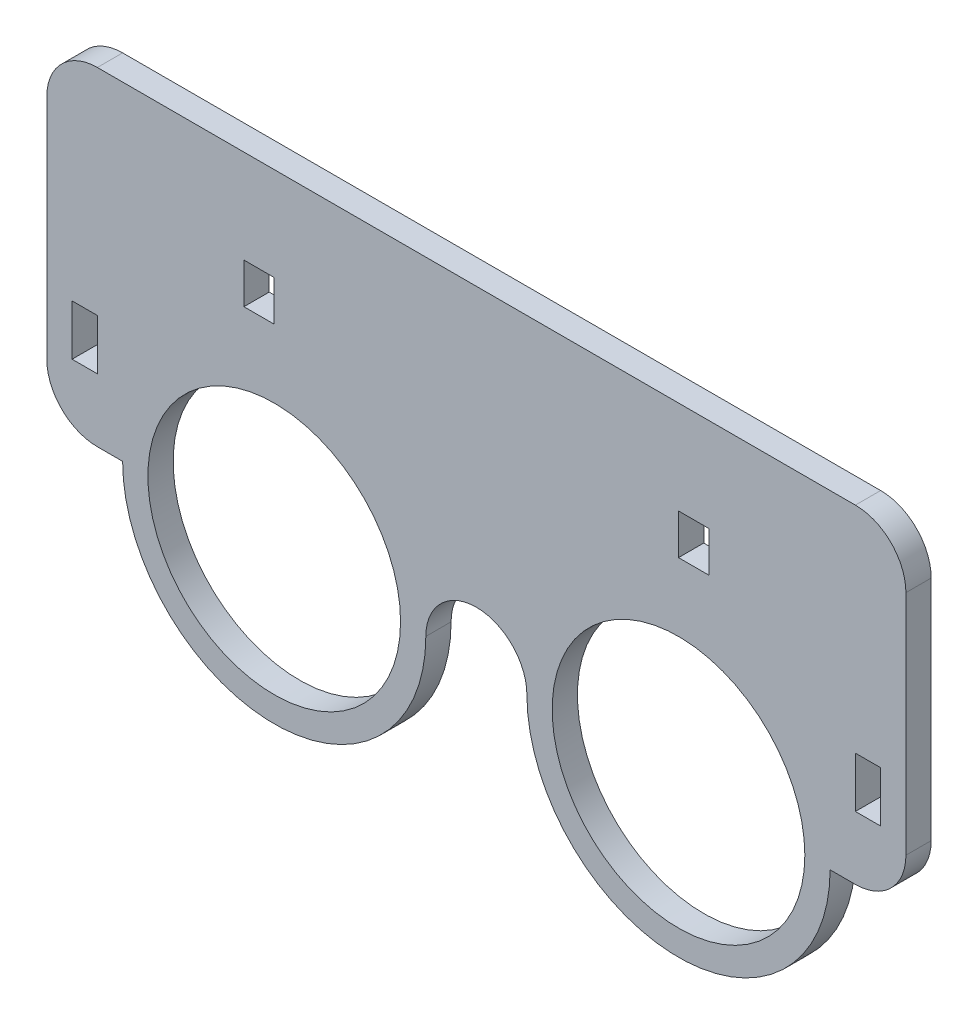
from build123d import *

# Parameters (mm, degrees)
SKETCH1_R           = 25
SKETCH1_W           = 5
SKETCH1_H           = 10
SKETCH1_W_2         = 6
SKETCH1_H_2         = 8
BOSS_EXTRUDE1_DEPTH = 5


with BuildPart() as part:
    # Sketch1 → Boss-Extrude1 (new body)
    with BuildSketch(Plane.XY):
        with BuildLine():
            Line((-85, 10), (-85, 55))
            ThreePointArc((-85, 55), (-82.071067812, 62.071067812), (-75, 65))
            Line((-75, 65), (75, 65))
            ThreePointArc((75, 65), (82.071067812, 62.071067812), (85, 55))
            Line((85, 55), (85, 10))
            ThreePointArc((85, 10), (82.071067812, 2.928932188), (75, 0))
            Line((75, 0), (70, 0))
            ThreePointArc((70, 0), (40, -30), (10, 0))
            ThreePointArc((10, 0), (0, 10), (-10, 0))
            ThreePointArc((-10, 0), (-40, -30), (-70, 0))
            Line((-70, 0), (-75, 0))
            ThreePointArc((-75, 0), (-82.071067812, 2.928932188), (-85, 10))
        make_face()
        with Locations((-40, 0)):
            Circle(SKETCH1_R, mode=Mode.SUBTRACT)
        with Locations((40, 0)):
            Circle(SKETCH1_R, mode=Mode.SUBTRACT)
        with Locations((77.5, 17.5)):
            Rectangle(SKETCH1_W, SKETCH1_H, mode=Mode.SUBTRACT)
        with Locations((-77.5, 17.5)):
            Rectangle(SKETCH1_W, SKETCH1_H, mode=Mode.SUBTRACT)
        with Locations((-43, 42.5)):
            Rectangle(SKETCH1_W_2, SKETCH1_H_2, mode=Mode.SUBTRACT)
        with Locations((43, 42.5)):
            Rectangle(SKETCH1_W_2, SKETCH1_H_2, mode=Mode.SUBTRACT)
    extrude(amount=BOSS_EXTRUDE1_DEPTH)


solid = part.part
